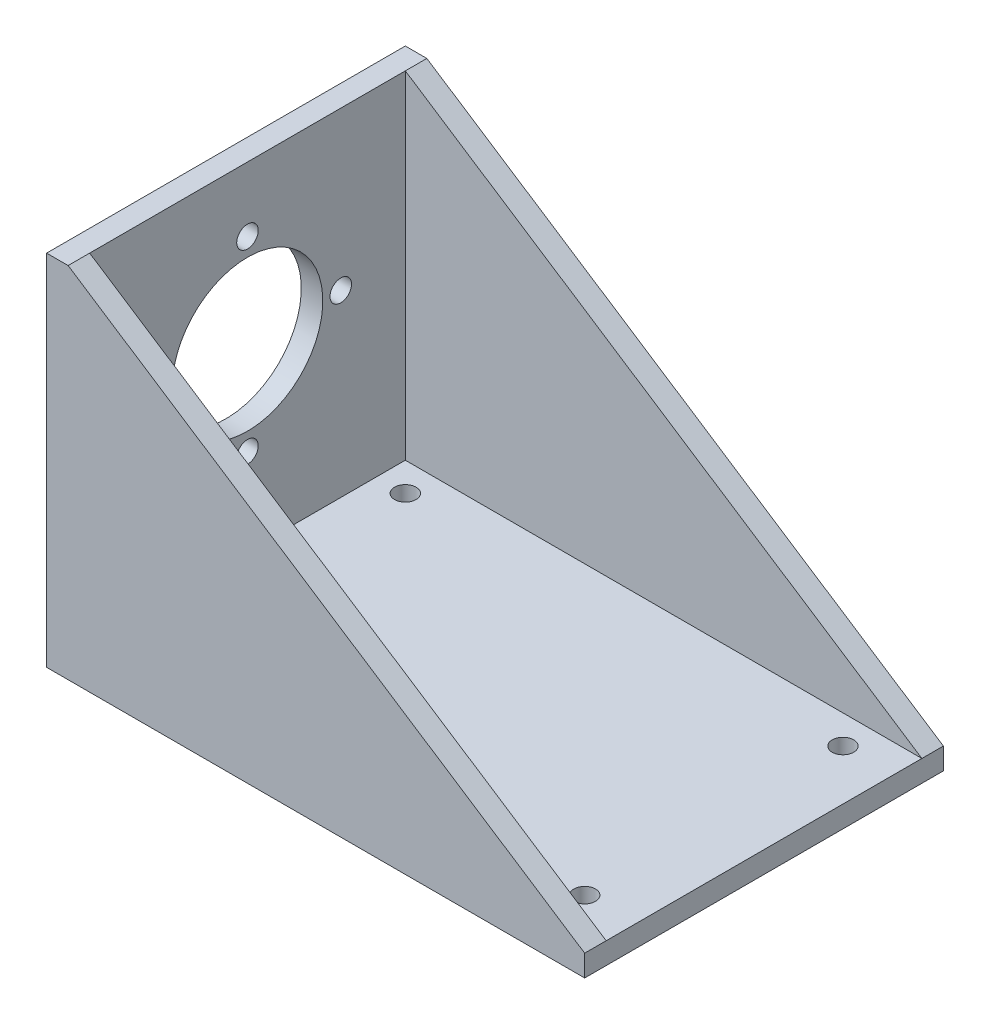
from build123d import *

# Parameters (mm, degrees)
ESQUISSE1_W             = 75
ESQUISSE1_H             = 50
BOSS_EXTRU_1_DEPTH      = 3
ESQUISSE2_W             = 3
ESQUISSE2_H             = 50
BOSS_EXTRU_2_DEPTH      = 47
ESQUISSE3_R             = 10.5
ESQUISSE3_R_2           = 1.5
ENL_V_MAT_EXTRU_1_DEPTH = 3
BOSS_EXTRU_3_DEPTH      = 3
BOSS_EXTRU_4_DEPTH      = 3
ESQUISSE6_R             = 1.5
ENL_V_MAT_EXTRU_2_DEPTH = 3


with BuildPart() as part:
    # Esquisse1 → Boss.-Extru.1 (new body)
    with BuildSketch(Plane(origin=(0, 0, 0), x_dir=(1, 0, 0), z_dir=(0, 1, 0))):
        with Locations((37.5, 25)):
            Rectangle(ESQUISSE1_W, ESQUISSE1_H)
    extrude(amount=BOSS_EXTRU_1_DEPTH)

    # Esquisse2 → Boss.-Extru.2 (add)
    with BuildSketch(Plane(origin=(0, 3, 0), x_dir=(1, 0, 0), z_dir=(0, 1, 0))):
        with Locations((1.5, 25)):
            Rectangle(ESQUISSE2_W, ESQUISSE2_H)
    extrude(amount=BOSS_EXTRU_2_DEPTH)

    # Esquisse3 → Enlèv. mat.-Extru.1 (cut)
    with BuildSketch(Plane.ZY):
        with Locations((-25, 28)):
            Circle(ESQUISSE3_R)
        with Locations((-12, 28)):
            Circle(ESQUISSE3_R_2)
        with Locations((-25, 15)):
            Circle(ESQUISSE3_R_2)
        with Locations((-38, 28)):
            Circle(ESQUISSE3_R_2)
        with Locations((-25, 41)):
            Circle(ESQUISSE3_R_2)
    extrude(amount=-ENL_V_MAT_EXTRU_1_DEPTH, mode=Mode.SUBTRACT)

    # Esquisse4 → Boss.-Extru.3 (add)
    with BuildSketch(Plane.XY):
        Polygon((3, 50), (75, 3), (3, 3), align=None)
    extrude(amount=-BOSS_EXTRU_3_DEPTH)

    # Esquisse5 → Boss.-Extru.4 (add)
    with BuildSketch(Plane(origin=(0, 0, -50), x_dir=(-1, 0, 0), z_dir=(0, 0, -1))):
        Polygon((-75, 3), (-3, 3), (-3, 50), align=None)
    extrude(amount=-BOSS_EXTRU_4_DEPTH)

    # Esquisse6 → Enlèv. mat.-Extru.2 (cut)
    with BuildSketch(Plane(origin=(0, 3, 0), x_dir=(1, 0, 0), z_dir=(0, 1, 0))):
        with Locations(Location((7, 43, 0), (0, 0, 270))):
            Circle(ESQUISSE6_R)
        with Locations(Location((68, 43, 0), (0, 0, 270))):
            Circle(ESQUISSE6_R)
        with Locations(Location((68, 7, 0), (0, 0, 270))):
            Circle(ESQUISSE6_R)
        with Locations(Location((7, 7, 0), (0, 0, 270))):
            Circle(ESQUISSE6_R)
    extrude(amount=-ENL_V_MAT_EXTRU_2_DEPTH, mode=Mode.SUBTRACT)


solid = part.part
